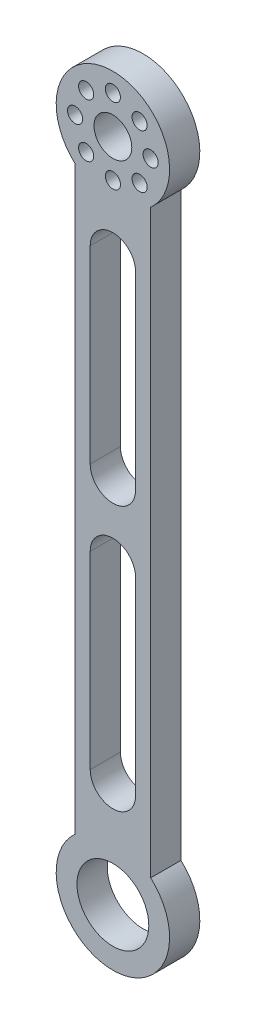
from build123d import *

# Parameters (mm, degrees)
SKETCH_1_R          = 9.5
EXTRUDE_1_DEPTH     = 8
SKETCH_3_R          = 2
CUT_EXTRUDE_2_DEPTH = 8
SKETCH_4_R          = 5
CUT_EXTRUDE_3_DEPTH = 8
SKETCH_5_W          = 12
SKETCH_5_H          = 120
CUT_EXTRUDE_4_DEPTH = 10
EXTRUDE_2_DEPTH     = 8


with BuildPart() as part:
    # 草图1 → 凸台-拉伸1 (new body)
    with BuildSketch(Plane.XY):
        with BuildLine():
            Line((-10, 76.819660113), (-10, -76.819660113))
            ThreePointArc((-10, -76.819660113), (0, -103), (10, -76.819660113))
            Line((10, -76.819660113), (10, 76.819660113))
            ThreePointArc((10, 76.819660113), (0, 103), (-10, 76.819660113))
        make_face()
        with Locations((0, -88)):
            Circle(SKETCH_1_R, mode=Mode.SUBTRACT)
    extrude(amount=EXTRUDE_1_DEPTH)

    # 草图3 → 切除-拉伸2 (cut)
    with BuildSketch(Plane.XY.offset(8)):
        with Locations((0, 98)):
            Circle(SKETCH_3_R)
        with Locations((10, 88)):
            Circle(SKETCH_3_R)
        with Locations((0, 78)):
            Circle(SKETCH_3_R)
        with Locations((-10, 88)):
            Circle(SKETCH_3_R)
        with Locations((7.071067812, 95.071067812)):
            Circle(SKETCH_3_R)
        with Locations((7.071067812, 80.928932188)):
            Circle(SKETCH_3_R)
        with Locations((-7.071067812, 80.928932188)):
            Circle(SKETCH_3_R)
        with Locations((-7.071067812, 95.071067812)):
            Circle(SKETCH_3_R)
    extrude(amount=-CUT_EXTRUDE_2_DEPTH, mode=Mode.SUBTRACT)

    # 草图4 → 切除-拉伸3 (cut)
    with BuildSketch(Plane.XY.offset(8)):
        with Locations((0, 88)):
            Circle(SKETCH_4_R)
    extrude(amount=-CUT_EXTRUDE_3_DEPTH, mode=Mode.SUBTRACT)

    # 草图5 → 切除-拉伸4 (cut)
    with BuildSketch(Plane.XY.offset(8)):
        with BuildLine():
            ThreePointArc((-6, 60), (0, 66), (6, 60))
            Line((6, 60), (-6, 60))
        make_face()
        Rectangle(SKETCH_5_W, SKETCH_5_H)
        with BuildLine():
            Line((-6, -60), (6, -60))
            ThreePointArc((6, -60), (0, -66), (-6, -60))
        make_face()
    extrude(amount=-CUT_EXTRUDE_4_DEPTH, mode=Mode.SUBTRACT)

    # 草图6 → 凸台-拉伸2 (add)
    with BuildSketch(Plane.XY.offset(8)):
        with BuildLine():
            Line((-6, 10), (-6, -10))
            ThreePointArc((-6, -10), (0, -4), (6, -10))
            Line((6, -10), (6, 10))
            ThreePointArc((6, 10), (0, 4), (-6, 10))
        make_face()
    extrude(amount=-EXTRUDE_2_DEPTH)


solid = part.part
